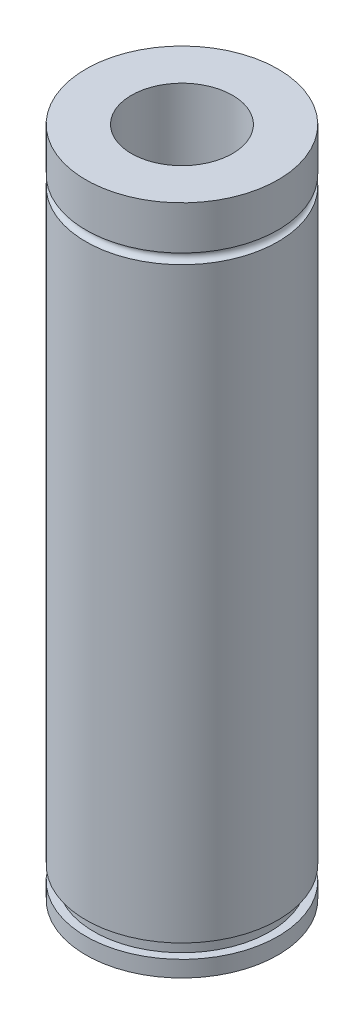
from build123d import *

# Parameters (mm, degrees)
M8_TAPPED_HOLE1_D           = 6.8
M8_TAPPED_HOLE1_DEPTH       = 16.75
M8_TAPPED_HOLE1_CSINK_D     = 8.05
M8_TAPPED_HOLE1_CSINK_ANGLE = 90
M8_TAPPED_HOLE1_TIP         = 2.042926105


with BuildPart() as part:
    # Sketch1 → Revolve1 (revolve)
    with BuildSketch(Plane.XY, mode=Mode.PRIVATE) as revolve1_sk:
        with BuildLine():
            Line((0, 0), (47.5, 0))
            Line((47.5, 0), (47.5, 8))
            Line((47.5, 8), (43.5, 8))
            Line((43.5, 8), (43.5, 15))
            Line((43.5, 15), (47.5, 15))
            Line((47.5, 15), (47.5, 305.5))
            ThreePointArc((47.5, 305.5), (45, 308), (47.5, 310.5))
            Line((47.5, 310.5), (47.5, 332))
            Line((47.5, 332), (25, 332))
            Line((25, 332), (25, 82))
            Line((25, 82), (0, 82))
            Line((0, 82), (0, 0))
        make_face()
    revolve(revolve1_sk.sketch.rotate(Axis((0, 0, 0), (0, 1, 0)), 90), axis=Axis((0, 0, 0), (0, 1, 0)))

    # M8 Tapped Hole1
    with Locations(Plane(origin=(21.213203436, 0, 21.213203436), x_dir=(0, 0, -1), z_dir=(0, -1, 0))):
        with Locations((0, 0), (0, -42.426406872), (42.426406872, -42.426406872), (42.426406872, 0)):
            CounterSinkHole(M8_TAPPED_HOLE1_D / 2, M8_TAPPED_HOLE1_CSINK_D / 2, depth=M8_TAPPED_HOLE1_DEPTH, counter_sink_angle=M8_TAPPED_HOLE1_CSINK_ANGLE)
            with Locations((0, 0, -(M8_TAPPED_HOLE1_DEPTH + M8_TAPPED_HOLE1_TIP / 2))):  # 118° drill point
                Cone(0, M8_TAPPED_HOLE1_D / 2, M8_TAPPED_HOLE1_TIP, mode=Mode.SUBTRACT)


solid = part.part
